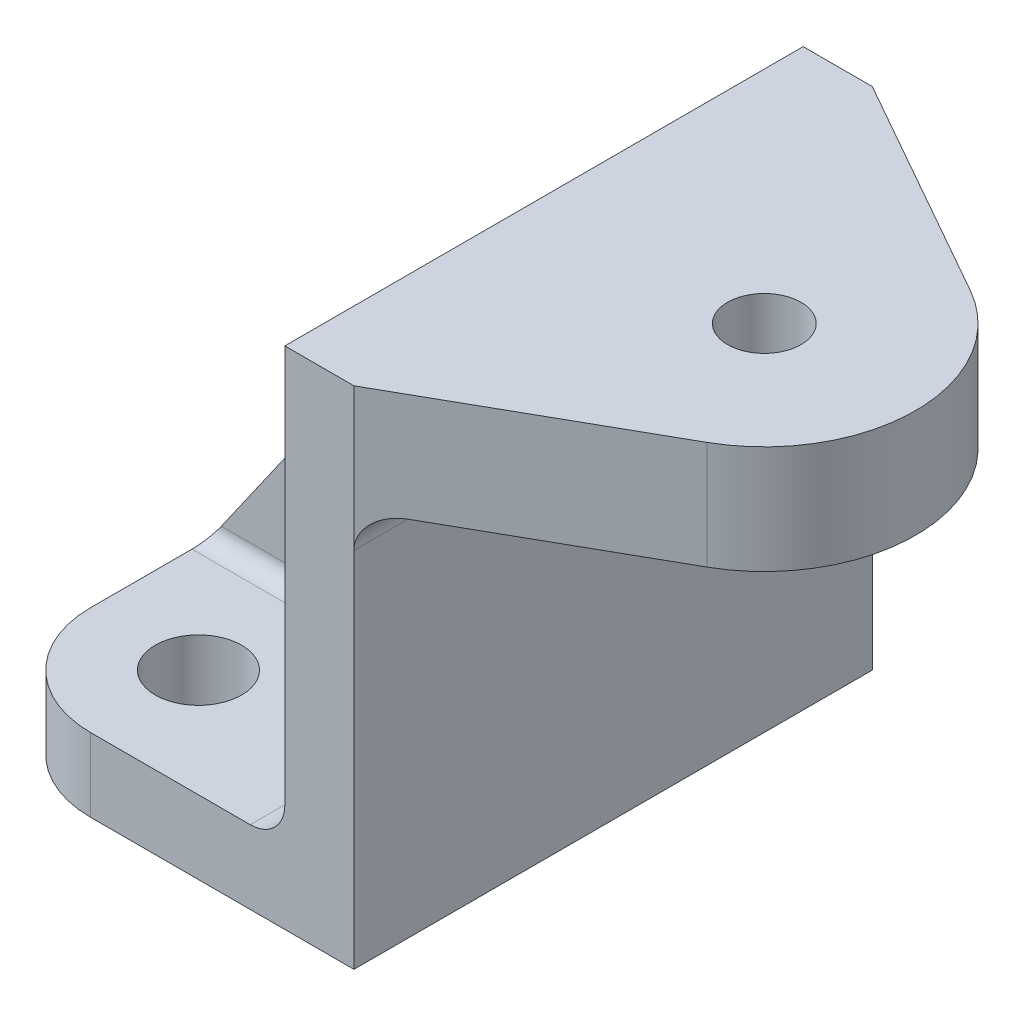
from build123d import *

# Parameters (mm, degrees)
SKETCH1_R           = 10
BOSS_EXTRUDE1_DEPTH = 17
SKETCH2_W           = 16
SKETCH2_H           = 120
BOSS_EXTRUDE2_DEPTH = 100
FILLET1_R           = 8
SKETCH3_R           = 8.5
BOSS_EXTRUDE3_DEPTH = 25
RIB2_REACH          = 167.497
SKETCH6_WALL_W      = 455.059513806
SKETCH6_WALL_H      = 15
FILLET2_R           = 4
FILLET3_R           = 8


with BuildPart() as part:
    # Sketch1 → Boss-Extrude1 (new body)
    with BuildSketch(Plane(origin=(0, 0, 0), x_dir=(1, 0, 0), z_dir=(0, 1, 0))):
        with BuildLine():
            Line((-30.5, 60), (30.5, 60))
            Line((30.5, 60), (30.5, -60))
            Line((30.5, -60), (-30.5, -60))
            ThreePointArc((-30.5, -60), (-48.17766953, -52.67766953), (-55.5, -35))
            Line((-55.5, -35), (-55.5, 35))
            ThreePointArc((-55.5, 35), (-48.17766953, 52.67766953), (-30.5, 60))
        make_face()
        with Locations(Location((-30.5, 35, 0), (0, 0, 270))):
            Circle(SKETCH1_R, mode=Mode.SUBTRACT)
        with Locations(Location((-30.5, -35, 0), (0, 0, 270))):
            Circle(SKETCH1_R, mode=Mode.SUBTRACT)
    extrude(amount=BOSS_EXTRUDE1_DEPTH)

    # Sketch2 → Boss-Extrude2 (add)
    with BuildSketch(Plane(origin=(0, 17, 0), x_dir=(1, 0, 0), z_dir=(0, 1, 0))):
        with Locations((22.5, 0)):
            Rectangle(SKETCH2_W, SKETCH2_H)
    extrude(amount=BOSS_EXTRUDE2_DEPTH)

    # Fillet1
    fillet1_edges = [part.edges().sort_by_distance(p)[0] for p in [
        (14.5, 17, 0),
    ]]
    fillet(fillet1_edges, radius=FILLET1_R)

    # Sketch3 → Boss-Extrude3 (add)
    with BuildSketch(Plane(origin=(0, 117, 0), x_dir=(1, 0, 0), z_dir=(0, 1, 0))):
        with BuildLine():
            Line((30.5, 60), (82.727979275, 30.466321244))
            ThreePointArc((82.727979275, 30.466321244), (100.5, 0), (82.727979275, -30.466321244))
            Line((82.727979275, -30.466321244), (30.5, -60))
            Line((30.5, -60), (30.5, 60))
        make_face()
        with Locations(Location((65.5, 0, 0), (0, 0, 270))):
            Circle(SKETCH3_R, mode=Mode.SUBTRACT)
    extrude(amount=-BOSS_EXTRUDE3_DEPTH)

    # Sketch6 wall → Rib2 (add, up to next)
    with BuildSketch(Plane(origin=(-20.5, 67, 0), x_dir=(-0.573462344363, -0.819231920519, 0), z_dir=(0.819231920519, -0.573462344363, 0)), mode=Mode.PRIVATE) as rib2_sk1:
        Rectangle(SKETCH6_WALL_W, SKETCH6_WALL_H)
    rib2_tool1 = extrude(rib2_sk1.sketch, amount=RIB2_REACH, mode=Mode.PRIVATE) - part.part
    add(rib2_tool1.solids().sort_by_distance((-20.5, 67, 0))[0])

    # Fillet2
    fillet2_edges = [part.edges().sort_by_distance(p)[0] for p in [
        (12.156854249, 19.343145751, -7.5),
        (-24.5, 17, -7.5),
        (14.5, 71, -7.5),
        (12.156854249, 19.343145751, 7.5),
        (-24.5, 17, 7.5),
        (14.5, 71, 7.5),
    ]]
    fillet(fillet2_edges, radius=FILLET2_R)

    # Fillet3
    fillet3_edges = [part.edges().sort_by_distance(p)[0] for p in [
        (30.5, 92, 0),
    ]]
    fillet(fillet3_edges, radius=FILLET3_R)


solid = part.part
